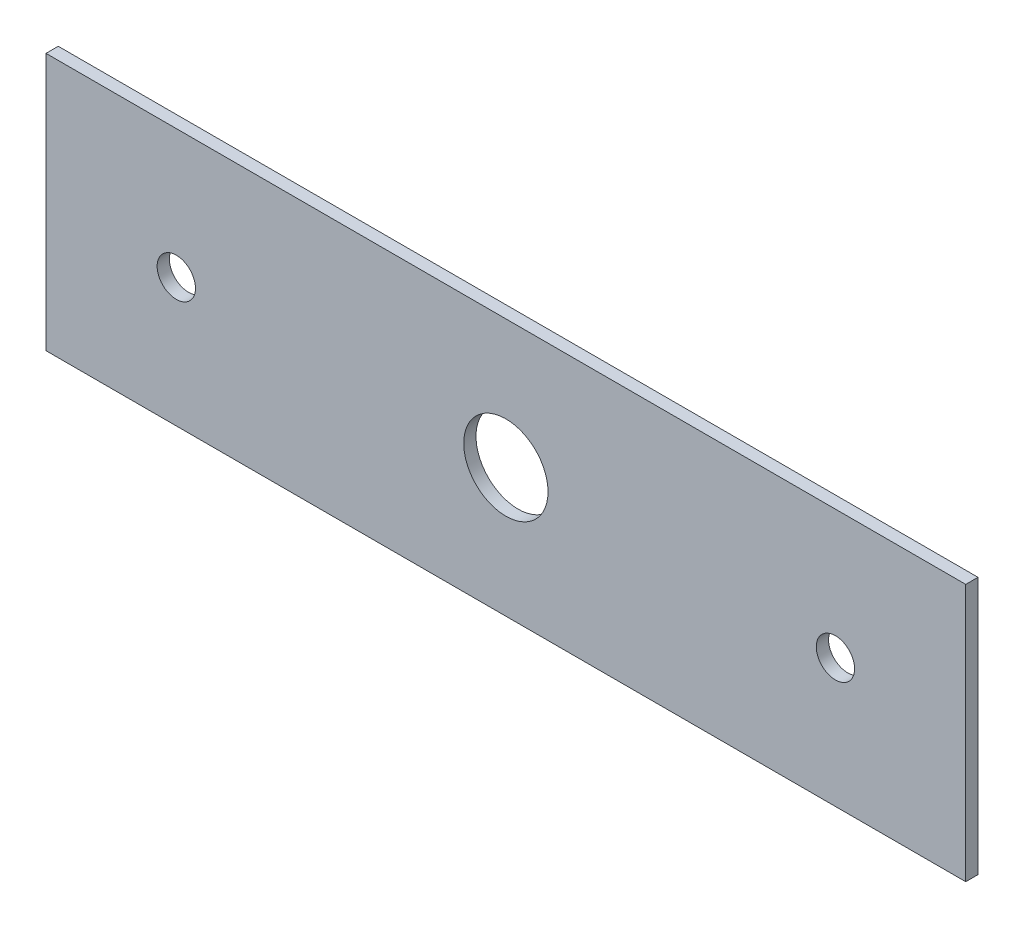
from build123d import *

# Parameters (mm, degrees)
SKETCH1_W           = 120
SKETCH1_H           = 33.6
SKETCH1_R           = 5.5
SKETCH1_R_2         = 2.5
BOSS_EXTRUDE1_DEPTH = 1.6


with BuildPart() as part:
    # Sketch1 → Boss-Extrude1 (new body)
    with BuildSketch(Plane.XY):
        Rectangle(SKETCH1_W, SKETCH1_H)
        Circle(SKETCH1_R, mode=Mode.SUBTRACT)
        with Locations((-43, 0)):
            Circle(SKETCH1_R_2, mode=Mode.SUBTRACT)
        with Locations((43, 0)):
            Circle(SKETCH1_R_2, mode=Mode.SUBTRACT)
    extrude(amount=BOSS_EXTRUDE1_DEPTH)


solid = part.part
